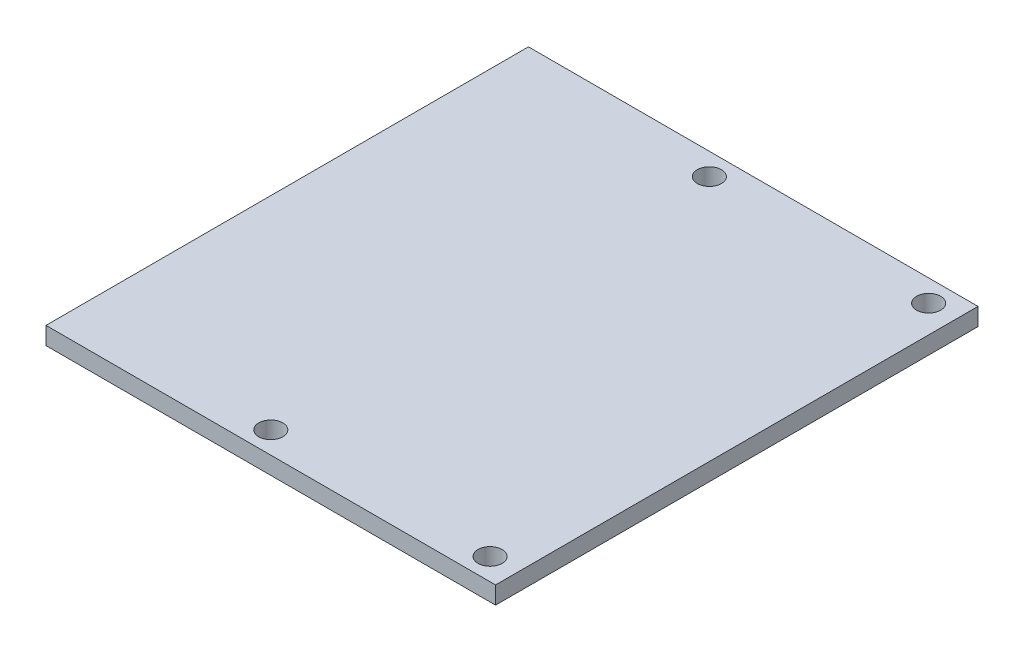
from build123d import *

# Parameters (mm, degrees)
SKETCH1_W           = 41
SKETCH1_H           = 44
SKETCH1_R           = 1.1
BOSS_EXTRUDE1_DEPTH = 1.6


with BuildPart() as part:
    # Sketch1 → Boss-Extrude1 (new body)
    with BuildSketch(Plane(origin=(0, 0, 0), x_dir=(1, 0, 0), z_dir=(0, 1, 0))):
        with Locations((20.5, 22)):
            Rectangle(SKETCH1_W, SKETCH1_H)
        with Locations(Location((38.5, 2, 0), (0, 0, 270))):
            Circle(SKETCH1_R, mode=Mode.SUBTRACT)
        with Locations(Location((18.5, 2, 0), (0, 0, 270))):
            Circle(SKETCH1_R, mode=Mode.SUBTRACT)
        with Locations(Location((38.5, 42, 0), (0, 0, 270))):
            Circle(SKETCH1_R, mode=Mode.SUBTRACT)
        with Locations(Location((18.5, 42, 0), (0, 0, 270))):
            Circle(SKETCH1_R, mode=Mode.SUBTRACT)
    extrude(amount=BOSS_EXTRUDE1_DEPTH)


solid = part.part
